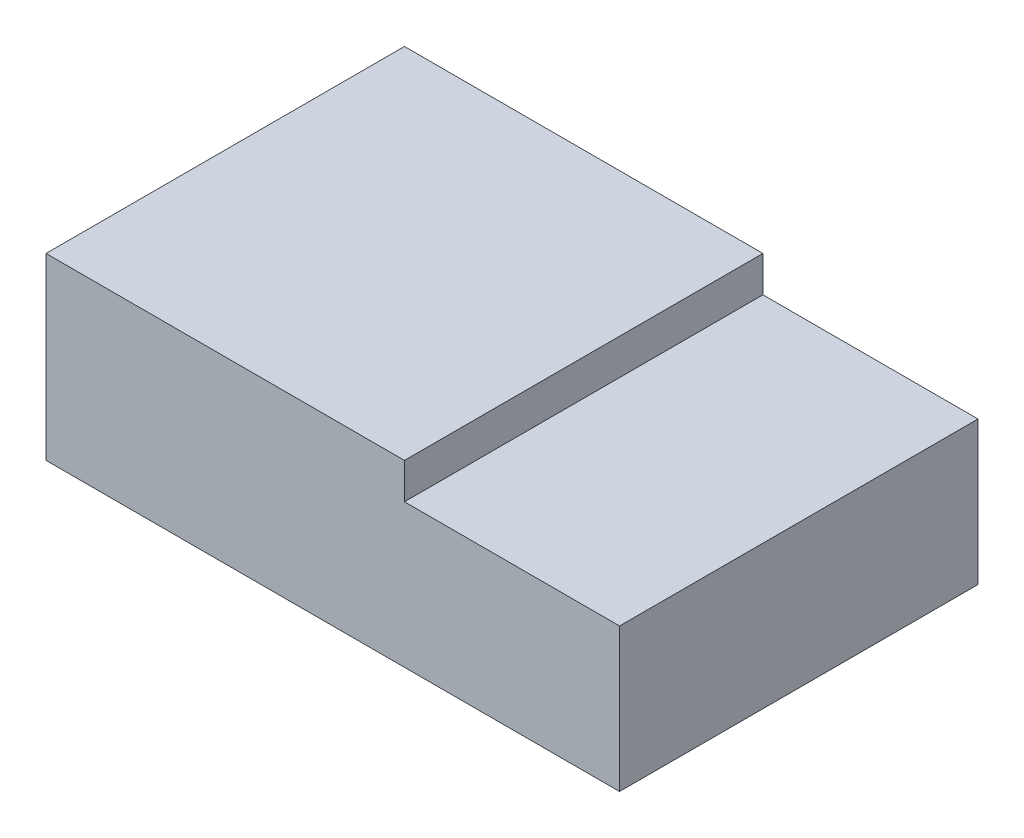
from build123d import *

# Parameters (mm, degrees)
BOSS_EXTRUDE1_DEPTH = 63.5


with BuildPart() as part:
    # Sketch1 → Boss-Extrude1 (new body)
    with BuildSketch(Plane.XY):
        Polygon((0, 0), (101.6, 0), (101.6, 25.4), (63.5, 25.4), (63.5, 31.75), (0, 31.75), align=None)
    extrude(amount=BOSS_EXTRUDE1_DEPTH)


solid = part.part
